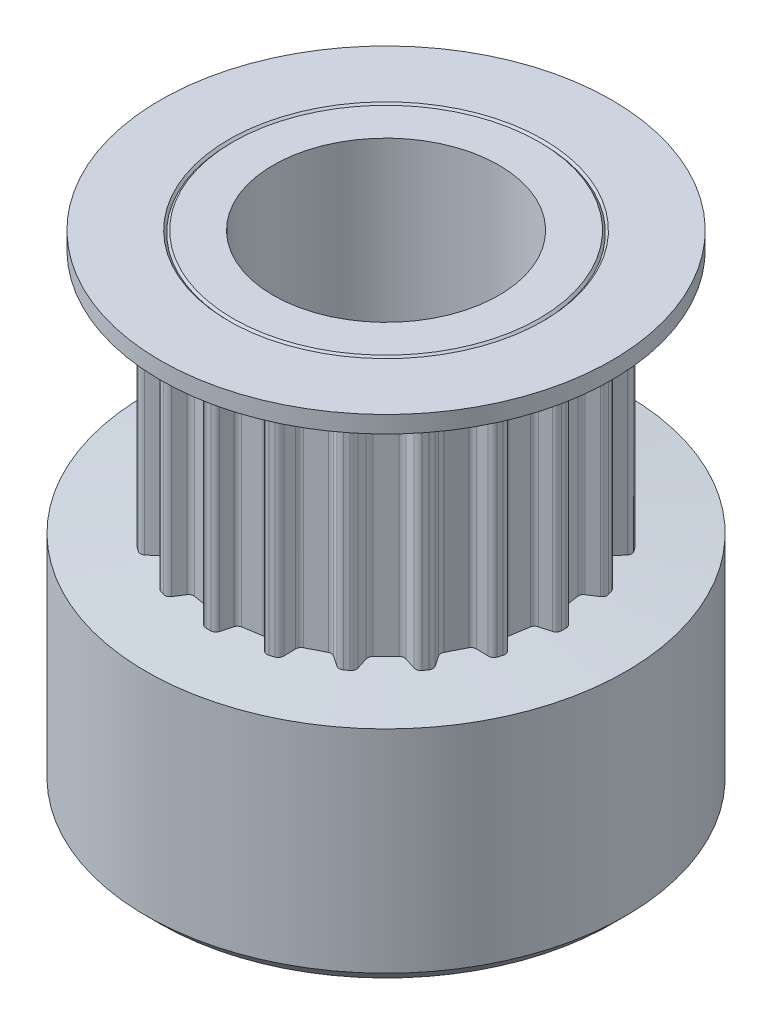
from build123d import *

# Parameters (mm, degrees)
TOOTH_DEPTH                = 4.35
TOOTH_PATTERN_COUNT        = 20
M3X0_5_SETSCEW_HOLE_REACH  = 22.882
M3X0_5_SETSCEW_HOLE_BORE_R = 1.25


with BuildPart() as part:
    # Sketch1 → Profile (revolve)
    with BuildSketch(Plane(origin=(0, 0, 0), x_dir=(0, 0, -1), z_dir=(1, 0, 0))):
        Polygon((4, -8.65), (4, 8.65), (5.425, 8.65), (5.5, 8.575), (5.575, 8.65), (7.999997357, 8.65), (7.999997357, 8.050000565), (5.5, 7.831279137), (5.5, -0.387534009), (8.5, -0.65), (8.5, -8.15), (8, -8.65), align=None)
    revolve(axis=Axis((0, -99.30835098, 0), (0, 1, 0)))

    # Sketch5 → Tooth (add, symmetric)
    with BuildSketch(Plane(origin=(0, 3.7, 0), x_dir=(-1, 0, 0), z_dir=(0, -1, 0))):
        with BuildLine():
            Line((-0.565527388, 5.681480478), (-1.217825514, 5.578166605))
            Line((-1.217825514, 5.578166605), (-1.066479855, 4.884938149))
            ThreePointArc((-1.066479855, 4.884938149), (-0.289177032, 4.99163066), (0.495246289, 4.975412658))
            Line((0.495246289, 4.975412658), (0.565527388, 5.681480478))
            ThreePointArc((0.565527388, 5.681480478), (0.470950203, 5.723588954), (0.410098195, 5.807344556))
            Line((0.410098195, 5.807344556), (0.270466085, 6.17109864))
            ThreePointArc((0.270466085, 6.17109864), (0.198160089, 6.263468737), (0.086495902, 6.299406199))
            ThreePointArc((0.086495902, 6.299406199), (0, 6.3), (-0.086495902, 6.299406199))
            ThreePointArc((-0.086495902, 6.299406199), (-0.198160089, 6.263468737), (-0.270466085, 6.17109864))
            Line((-0.270466085, 6.17109864), (-0.410098195, 5.807344556))
            ThreePointArc((-0.410098195, 5.807344556), (-0.470950203, 5.723588954), (-0.565527388, 5.681480478))
        make_face()
    tooth = extrude(amount=TOOTH_DEPTH, both=True)

    # Tooth Pattern: Tooth ×20 about axis
    tooth_pattern_axis = Axis((0, 0, 0), (0, 1, 0))
    for i in range(1, TOOTH_PATTERN_COUNT):
        add(tooth.rotate(tooth_pattern_axis, i * 360 / TOOTH_PATTERN_COUNT))

    # M3x0.5 Setscew Hole bore → M3x0.5 Setscew Hole (cut, up to next)
    with BuildSketch(Plane(origin=(0, 0, -8.5), x_dir=(-1, 0, 0), z_dir=(0, 0, -1)), mode=Mode.PRIVATE) as m3x0_5_setscew_hole_sk1:
        with Locations((0, -4.65)):
            Circle(M3X0_5_SETSCEW_HOLE_BORE_R)
    m3x0_5_setscew_hole_tool1 = extrude(m3x0_5_setscew_hole_sk1.sketch, amount=-M3X0_5_SETSCEW_HOLE_REACH, mode=Mode.PRIVATE) & part.part
    add(m3x0_5_setscew_hole_tool1.solids().sort_by_distance((0, -4.65, -8.5))[0], mode=Mode.SUBTRACT)


solid = part.part
